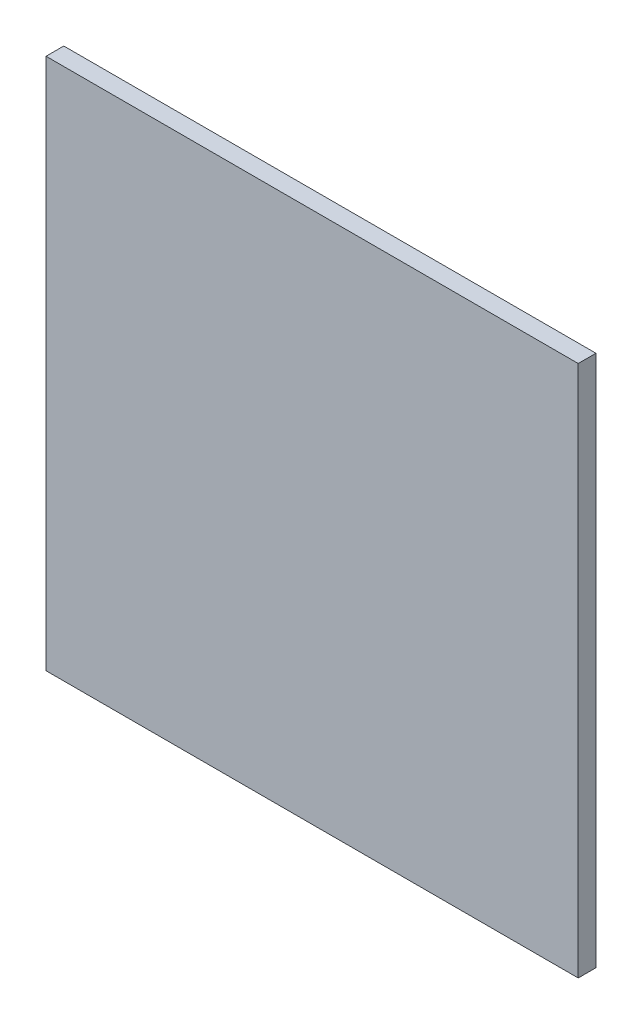
from build123d import *

# Parameters (mm, degrees)
SKETCH1_W           = 3000
SKETCH1_H           = 3000
BOSS_EXTRUDE1_DEPTH = 100


with BuildPart() as part:
    # Sketch1 → Boss-Extrude1 (new body)
    with BuildSketch(Plane.XY):
        Rectangle(SKETCH1_W, SKETCH1_H)
    extrude(amount=-BOSS_EXTRUDE1_DEPTH)


solid = part.part
